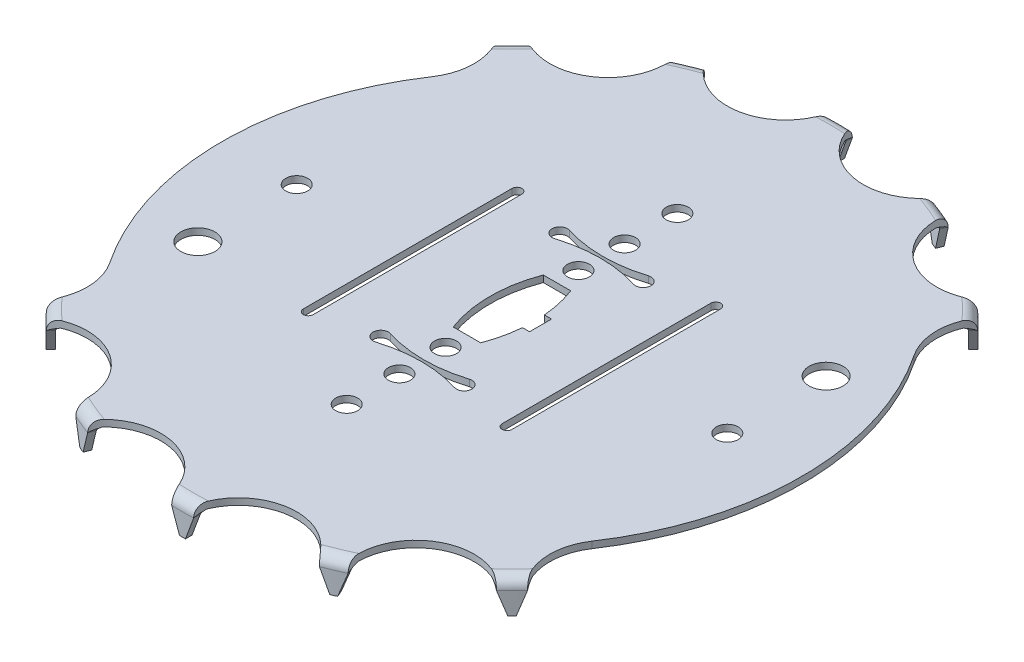
from build123d import *

# Parameters (mm, degrees)
SKETCH1_OUTSIDE_W = 40.49
SKETCH1_OUTSIDE_H = 40.49
EXTRUDE3_DEPTH    = 22.266170389
EXTRUDE4_DEPTH    = 2
CIRPATTERN1_COUNT = 16
SKETCH10_R        = 0.5
EXTRUDE5_DEPTH    = 21.03721545
EXTRUDE6_DEPTH    = 9.8
SKETCH12_R        = 0.5
SKETCH12_R_2      = 0.775
EXTRUDE7_DEPTH    = 9.8
EXTRUDE8_DEPTH    = 9.8


with BuildPart() as part:
    # Sketch6 → Revolve-Thin1 (revolve)
    with BuildSketch(Plane.XY, mode=Mode.PRIVATE) as revolve_thin1_sk:
        with BuildLine():
            Line((0, 0), (14.5, 0))
            ThreePointArc((14.5, 0), (14.853553391, -0.146446609), (15, -0.5))
            Line((15, -0.5), (15, -1.5))
            Line((15, -1.5), (14.7, -1.5))
            Line((14.7, -1.5), (14.7, -0.5))
            ThreePointArc((14.7, -0.5), (14.641421356, -0.358578644), (14.5, -0.3))
            Line((14.5, -0.3), (0, -0.3))
            Line((0, -0.3), (0, 0))
        make_face()
    revolve(revolve_thin1_sk.sketch.rotate(Axis((0, -1.577397508, 0), (0, 1, 0)), 90), axis=Axis((0, -1.577397508, 0), (0, 1, 0)))

    # Sketch1 outside → Extrude3 (cut, through all)
    with BuildSketch(Plane(origin=(0, 0, 0), x_dir=(1, 0, 0), z_dir=(0, 1, 0))):
        Rectangle(SKETCH1_OUTSIDE_W, SKETCH1_OUTSIDE_H)
        with BuildLine():
            ThreePointArc((10.954260914, 10.247154133), (10.606601718, 10.606601718), (10.247154133, 10.954260914))
            ThreePointArc((10.247154133, 10.954260914), (7.333527076, 10.975398882), (6.199001337, 13.659150136))
            ThreePointArc((6.199001337, 13.659150136), (5.740251485, 13.858192988), (5.275121804, 14.041833568))
            ThreePointArc((5.275121804, 14.041833568), (2.575192251, 12.946365701), (0.5, 14.991664351))
            ThreePointArc((0.5, 14.991664351), (0, 15), (-0.5, 14.991664351))
            ThreePointArc((-0.5, 14.991664351), (-2.575192251, 12.946365701), (-5.275121804, 14.041833568))
            ThreePointArc((-5.275121804, 14.041833568), (-5.740251485, 13.858192988), (-6.199001337, 13.659150136))
            ThreePointArc((-6.199001337, 13.659150136), (-7.333527076, 10.975398882), (-10.247154133, 10.954260914))
            ThreePointArc((-10.247154133, 10.954260914), (-10.606601718, 10.606601718), (-10.954260914, 10.247154133))
            ThreePointArc((-10.954260914, 10.247154133), (-10.528674694, 8.787176358), (-10.975398882, 7.333527076))
            ThreePointArc((-10.975398882, 7.333527076), (-13.2, 0), (-10.975398882, -7.333527076))
            ThreePointArc((-10.975398882, -7.333527076), (-10.528674694, -8.787176358), (-10.954260914, -10.247154133))
            ThreePointArc((-10.954260914, -10.247154133), (-10.606601718, -10.606601718), (-10.247154133, -10.954260914))
            ThreePointArc((-10.247154133, -10.954260914), (-7.333527076, -10.975398882), (-6.199001337, -13.659150136))
            ThreePointArc((-6.199001337, -13.659150136), (-5.740251485, -13.858192988), (-5.275121804, -14.041833568))
            ThreePointArc((-5.275121804, -14.041833568), (-2.575192251, -12.946365701), (-0.5, -14.991664351))
            ThreePointArc((-0.5, -14.991664351), (0, -15), (0.5, -14.991664351))
            ThreePointArc((0.5, -14.991664351), (2.575192251, -12.946365701), (5.275121804, -14.041833568))
            ThreePointArc((5.275121804, -14.041833568), (5.740251485, -13.858192988), (6.199001337, -13.659150136))
            ThreePointArc((6.199001337, -13.659150136), (7.333527076, -10.975398882), (10.247154133, -10.954260914))
            ThreePointArc((10.247154133, -10.954260914), (10.606601718, -10.606601718), (10.954260914, -10.247154133))
            ThreePointArc((10.954260914, -10.247154133), (10.528674694, -8.787176358), (10.975398882, -7.333527076))
            ThreePointArc((10.975398882, -7.333527076), (13.2, 0), (10.975398882, 7.333527076))
            ThreePointArc((10.975398882, 7.333527076), (10.528674694, 8.787176358), (10.954260914, 10.247154133))
        make_face(mode=Mode.SUBTRACT)
    extrude(amount=-EXTRUDE3_DEPTH, mode=Mode.SUBTRACT)

    # Sketch8 → Extrude4 (cut)
    with BuildSketch(Plane.XY.offset(15)):
        with BuildLine():
            Line((-0.5, -0.5), (-0.136029766, -1.5))
            Line((-0.136029766, -1.5), (0.136029766, -1.5))
            Line((0.136029766, -1.5), (0.5, -0.5))
            ThreePointArc((0.5, -0.5), (0.564660906, -0.386195364), (0.663164141, -0.3))
            Line((0.663164141, -0.3), (0.663164141, -1.8))
            Line((0.663164141, -1.8), (-0.663164141, -1.8))
            Line((-0.663164141, -1.8), (-0.663164141, -0.3))
            ThreePointArc((-0.663164141, -0.3), (-0.564660906, -0.386195364), (-0.5, -0.5))
        make_face()
    extrude4 = extrude(amount=-EXTRUDE4_DEPTH, mode=Mode.SUBTRACT)

    # CirPattern1: Extrude4 ×16 about axis
    cirpattern1_axis = Axis((0, 0, 0), (0, 1, 0))
    for i in range(1, CIRPATTERN1_COUNT):
        add(extrude4.rotate(cirpattern1_axis, i * 360 / CIRPATTERN1_COUNT), mode=Mode.SUBTRACT)

    # Sketch10 → Extrude5 (cut, through all)
    with BuildSketch(Plane(origin=(0, 0, 0), x_dir=(1, 0, 0), z_dir=(0, 1, 0))):
        with Locations(Location((0, 3.025, 0), (0, 0, 270))):
            Circle(SKETCH10_R)
        with Locations(Location((0, 5.125, 0), (0, 0, 270))):
            Circle(SKETCH10_R)
        with Locations(Location((0, 7.525, 0), (0, 0, 270))):
            Circle(SKETCH10_R)
        with Locations(Location((0, -3.025, 0), (0, 0, 270))):
            Circle(SKETCH10_R)
        with Locations(Location((0, -5.125, 0), (0, 0, 270))):
            Circle(SKETCH10_R)
        with Locations(Location((0, -7.525, 0), (0, 0, 270))):
            Circle(SKETCH10_R)
    extrude(amount=-EXTRUDE5_DEPTH, mode=Mode.SUBTRACT)

    # Sketch11 → Extrude6 (cut)
    with BuildSketch(Plane(origin=(0, 0, 0), x_dir=(1, 0, 0), z_dir=(0, 1, 0))):
        with BuildLine():
            Line((-4.3, 4.75), (-4.3, -4.75))
            ThreePointArc((-4.3, -4.75), (-4.525, -4.975), (-4.75, -4.75))
            Line((-4.75, -4.75), (-4.75, 4.75))
            ThreePointArc((-4.75, 4.75), (-4.525, 4.975), (-4.3, 4.75))
        make_face()
        with BuildLine():
            Line((4.75, 4.75), (4.75, -4.75))
            ThreePointArc((4.75, -4.75), (4.525, -4.975), (4.3, -4.75))
            Line((4.3, -4.75), (4.3, 4.75))
            ThreePointArc((4.3, 4.75), (4.525, 4.975), (4.75, 4.75))
        make_face()
        with BuildLine():
            ThreePointArc((-1.795275591, 4.408965265), (-2.25, 4.075), (-1.795275591, 3.741034735))
            ThreePointArc((-1.795275591, 3.741034735), (0, 4.015915911), (1.795275591, 3.741034735))
            ThreePointArc((1.795275591, 3.741034735), (2.25, 4.075), (1.795275591, 4.408965265))
            ThreePointArc((1.795275591, 4.408965265), (0, 4.134084089), (-1.795275591, 4.408965265))
        make_face()
        with BuildLine():
            ThreePointArc((1.795275591, -4.408965265), (2.25, -4.075), (1.795275591, -3.741034735))
            ThreePointArc((1.795275591, -3.741034735), (0, -4.015915911), (-1.795275591, -3.741034735))
            ThreePointArc((-1.795275591, -3.741034735), (-2.25, -4.075), (-1.795275591, -4.408965265))
            ThreePointArc((-1.795275591, -4.408965265), (0, -4.134084089), (1.795275591, -4.408965265))
        make_face()
    extrude(amount=-EXTRUDE6_DEPTH, mode=Mode.SUBTRACT)

    # Sketch12 → Extrude7 (cut)
    with BuildSketch(Plane(origin=(0, 0, 0), x_dir=(1, 0, 0), z_dir=(0, 1, 0))):
        with Locations(Location((-9.8, 0, 0), (0, 0, 270))):
            Circle(SKETCH12_R)
        with Locations(Location((9.8, 0, 0), (0, 0, 270))):
            Circle(SKETCH12_R)
        with Locations(Location((9.8, 4.5, 0), (0, 0, 270))):
            Circle(SKETCH12_R_2)
        with Locations(Location((-9.8, -4.5, 0), (0, 0, 270))):
            Circle(SKETCH12_R_2)
    extrude(amount=-EXTRUDE7_DEPTH, mode=Mode.SUBTRACT)

    # Sketch13 → Extrude8 (cut)
    with BuildSketch(Plane(origin=(0, 0, 0), x_dir=(1, 0, 0), z_dir=(0, 1, 0))):
        with BuildLine():
            Line((-0.625, -2.05), (0.625, -2.05))
            ThreePointArc((0.625, -2.05), (0.854741056, -1.287143138), (0.977774482, -0.5))
            Line((0.977774482, -0.5), (1.3, -0.5))
            Line((1.3, -0.5), (1.3, 0.5))
            Line((1.3, 0.5), (0.977774482, 0.5))
            ThreePointArc((0.977774482, 0.5), (0.854741056, 1.287143138), (0.625, 2.05))
            Line((0.625, 2.05), (-0.625, 2.05))
            ThreePointArc((-0.625, 2.05), (-0.905007241, 1.041951318), (-0.999366396, 0))
            ThreePointArc((-0.999366396, 0), (-0.905007241, -1.041951318), (-0.625, -2.05))
        make_face()
    extrude(amount=-EXTRUDE8_DEPTH, mode=Mode.SUBTRACT)


solid = part.part
